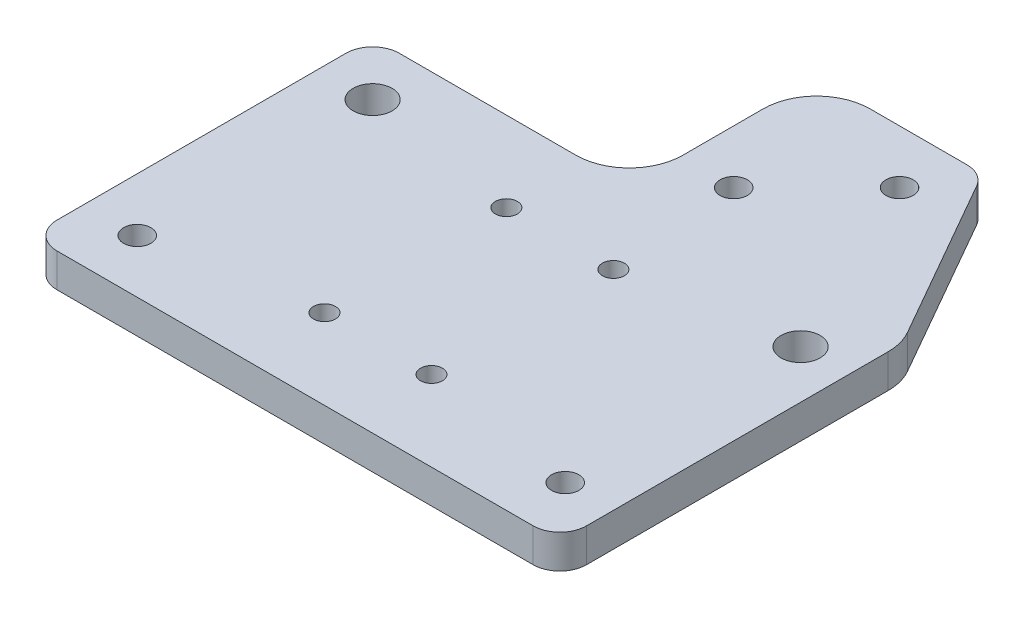
from build123d import *

# Parameters (mm, degrees)
BOSS_EXTRUDE2_DEPTH = 6.3
SKETCH1_7_R         = 2.55
CUT_EXTRUDE3_DEPTH  = 141.148813766
SKETCH1_8_R         = 3.65
CUT_EXTRUDE4_DEPTH  = 141.148813766
SKETCH1_9_R         = 2.55
CUT_EXTRUDE5_DEPTH  = 141.148813766
SKETCH1_10_R        = 3.65
CUT_EXTRUDE6_DEPTH  = 141.148813766
SKETCH1_11_R        = 2.05
CUT_EXTRUDE8_DEPTH  = 141.148813766
SKETCH1_12_R        = 2.05
CUT_EXTRUDE10_DEPTH = 141.148813766
SKETCH1_13_R        = 2.55
CUT_EXTRUDE11_DEPTH = 141.148813766
SKETCH1_14_R        = 2.05
CUT_EXTRUDE12_DEPTH = 141.148813766
SKETCH1_15_R        = 2.05
CUT_EXTRUDE13_DEPTH = 141.148813766
SKETCH1_16_R        = 2.55
CUT_EXTRUDE14_DEPTH = 141.148813766
FILLET1_R           = 5
FILLET2_R           = 5
FILLET3_R           = 10
FILLET4_R           = 10
FILLET5_R           = 10


with BuildPart() as part:
    # Sketch1 → Boss-Extrude2 (new body)
    with BuildSketch(Plane(origin=(0, 0, 0), x_dir=(1, 0, 0), z_dir=(0, 1, 0))):
        Polygon((0, 64), (48, 64), (48, 99), (79, 99), (99, 64), (99, 0), (0, 0), align=None)
    extrude(amount=BOSS_EXTRUDE2_DEPTH)

    # Sketch1<7> → Cut-Extrude3 (cut, through all)
    with BuildSketch(Plane(origin=(0, 0, 0), x_dir=(1, 0, 0), z_dir=(0, 1, 0))):
        with Locations((73.5, 89)):
            Circle(SKETCH1_7_R)
    extrude(amount=CUT_EXTRUDE3_DEPTH, mode=Mode.SUBTRACT)

    # Sketch1<8> → Cut-Extrude4 (cut, through all)
    with BuildSketch(Plane(origin=(0, 0, 0), x_dir=(1, 0, 0), z_dir=(0, 1, 0))):
        with Locations((90, 54)):
            Circle(SKETCH1_8_R)
    extrude(amount=CUT_EXTRUDE4_DEPTH, mode=Mode.SUBTRACT)

    # Sketch1<9> → Cut-Extrude5 (cut, through all)
    with BuildSketch(Plane(origin=(0, 0, 0), x_dir=(1, 0, 0), z_dir=(0, 1, 0))):
        with Locations((58, 73.5)):
            Circle(SKETCH1_9_R)
    extrude(amount=CUT_EXTRUDE5_DEPTH, mode=Mode.SUBTRACT)

    # Sketch1<10> → Cut-Extrude6 (cut, through all)
    with BuildSketch(Plane(origin=(0, 0, 0), x_dir=(1, 0, 0), z_dir=(0, 1, 0))):
        with Locations((10, 54)):
            Circle(SKETCH1_10_R)
    extrude(amount=CUT_EXTRUDE6_DEPTH, mode=Mode.SUBTRACT)

    # Sketch1<11> → Cut-Extrude8 (cut, through all)
    with BuildSketch(Plane(origin=(0, 0, 0), x_dir=(1, 0, 0), z_dir=(0, 1, 0))):
        with Locations((60, 49)):
            Circle(SKETCH1_11_R)
    extrude(amount=CUT_EXTRUDE8_DEPTH, mode=Mode.SUBTRACT)

    # Sketch1<12> → Cut-Extrude10 (cut, through all)
    with BuildSketch(Plane(origin=(0, 0, 0), x_dir=(1, 0, 0), z_dir=(0, 1, 0))):
        with Locations((40, 49)):
            Circle(SKETCH1_12_R)
    extrude(amount=CUT_EXTRUDE10_DEPTH, mode=Mode.SUBTRACT)

    # Sketch1<13> → Cut-Extrude11 (cut, through all)
    with BuildSketch(Plane(origin=(0, 0, 0), x_dir=(1, 0, 0), z_dir=(0, 1, 0))):
        with Locations((90, 10)):
            Circle(SKETCH1_13_R)
    extrude(amount=CUT_EXTRUDE11_DEPTH, mode=Mode.SUBTRACT)

    # Sketch1<14> → Cut-Extrude12 (cut, through all)
    with BuildSketch(Plane(origin=(0, 0, 0), x_dir=(1, 0, 0), z_dir=(0, 1, 0))):
        with Locations((60, 15)):
            Circle(SKETCH1_14_R)
    extrude(amount=CUT_EXTRUDE12_DEPTH, mode=Mode.SUBTRACT)

    # Sketch1<15> → Cut-Extrude13 (cut, through all)
    with BuildSketch(Plane(origin=(0, 0, 0), x_dir=(1, 0, 0), z_dir=(0, 1, 0))):
        with Locations((40, 15)):
            Circle(SKETCH1_15_R)
    extrude(amount=CUT_EXTRUDE13_DEPTH, mode=Mode.SUBTRACT)

    # Sketch1<16> → Cut-Extrude14 (cut, through all)
    with BuildSketch(Plane(origin=(0, 0, 0), x_dir=(1, 0, 0), z_dir=(0, 1, 0))):
        with Locations((10, 10)):
            Circle(SKETCH1_16_R)
    extrude(amount=CUT_EXTRUDE14_DEPTH, mode=Mode.SUBTRACT)

    # Fillet1
    fillet1_edges = [part.edges().sort_by_distance(p)[0] for p in [
        (0, 3.15, -64),
        (0, 3.15, 0),
        (99, 3.15, 0),
    ]]
    fillet(fillet1_edges, radius=FILLET1_R)

    # Fillet2
    fillet2_edges = [part.edges().sort_by_distance(p)[0] for p in [
        (79, 3.15, -99),
    ]]
    fillet(fillet2_edges, radius=FILLET2_R)

    # Fillet3
    fillet3_edges = [part.edges().sort_by_distance(p)[0] for p in [
        (48, 3.15, -99),
    ]]
    fillet(fillet3_edges, radius=FILLET3_R)

    # Fillet4
    fillet4_edges = [part.edges().sort_by_distance(p)[0] for p in [
        (99, 3.15, -64),
    ]]
    fillet(fillet4_edges, radius=FILLET4_R)

    # Fillet5
    fillet5_edges = [part.edges().sort_by_distance(p)[0] for p in [
        (48, 3.15, -64),
    ]]
    fillet(fillet5_edges, radius=FILLET5_R)


solid = part.part
